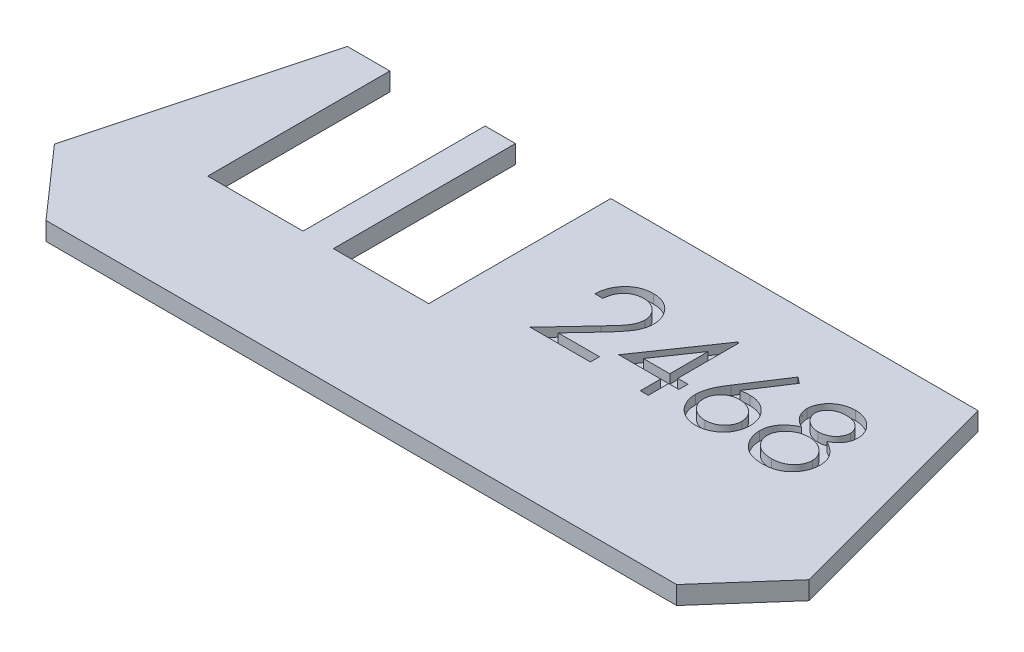
from build123d import *

# Parameters (mm, degrees)
BOSS_EXTRUDE1_DEPTH = 1.524
CUT_EXTRUDE1_REACH  = 36.032
SKETCH3_W           = 7.9756
SKETCH3_H           = 15.24
CUT_EXTRUDE2_DEPTH  = 0.762


with BuildPart() as part:
    # Sketch1 → Boss-Extrude1 (new body)
    with BuildSketch(Plane(origin=(0, 0, 0), x_dir=(1, 0, 0), z_dir=(0, 1, 0))):
        Polygon((-26.3906, 12.6111), (-31.5722, -6.726894464), (-26.3906, -12.6111), (26.3906, -12.6111), (31.5722, -6.726894464), (26.3906, 12.6111), align=None)
    extrude(amount=BOSS_EXTRUDE1_DEPTH)

    # Sketch3 → Cut-Extrude1 (cut, up to next)
    with BuildSketch(Plane(origin=(0, 1.524, 0), x_dir=(1, 0, 0), z_dir=(0, 1, 0)), mode=Mode.PRIVATE) as cut_extrude1_sk1:
        with Locations((-18.8468, 4.9911)):
            Rectangle(SKETCH3_W, SKETCH3_H)
    cut_extrude1_tool1 = extrude(cut_extrude1_sk1.sketch, amount=-CUT_EXTRUDE1_REACH, mode=Mode.PRIVATE) & part.part
    # Sketch3 → Cut-Extrude1 (cut, up to next)
    with BuildSketch(Plane(origin=(0, 1.524, 0), x_dir=(1, 0, 0), z_dir=(0, 1, 0)), mode=Mode.PRIVATE) as cut_extrude1_sk2:
        with Locations((-8.3312, 4.9911)):
            Rectangle(SKETCH3_W, SKETCH3_H)
    cut_extrude1_tool2 = extrude(cut_extrude1_sk2.sketch, amount=-CUT_EXTRUDE1_REACH, mode=Mode.PRIVATE) & part.part
    add(cut_extrude1_tool1.solids().sort_by_distance((-18.8468, 1.524, -4.9911))[0], mode=Mode.SUBTRACT)
    add(cut_extrude1_tool2.solids().sort_by_distance((-8.3312, 1.524, -4.9911))[0], mode=Mode.SUBTRACT)

    # Sketch2 → Cut-Extrude2 (cut)
    # profile 1 of 4: a face of its own
    with BuildSketch(Plane(origin=(0, 1.524, 0), x_dir=(1, 0, 0), z_dir=(0, 1, 0))):
        with BuildLine():
            Line((2.562363697, 5.039946154), (1.897513269, 5.039946154))
            add(Edge.make_bspline(
                [(1.897513269, 5.039946154), (1.90184641, 5.128149533), (1.910356583, 5.301378622), (1.950209795, 5.553947557), (2.007234652, 5.795363548), (2.087861563, 6.023688199), (2.187993184, 6.240940341), (2.308071742, 6.446257041), (2.450298725, 6.638855057), (2.611602979, 6.816948942), (2.786796598, 6.9803293), (2.975827504, 7.121416231), (3.174466145, 7.240621969), (3.382109873, 7.340277264), (3.601101399, 7.415079938), (3.829453448, 7.470582408), (4.068169287, 7.503975673), (4.230814, 7.507565086), (4.313532233, 7.509390598)],
                knots=[0, 0, 0, 0, 1.10065271, 2.161652631, 3.183658789, 4.190468796, 5.17591951, 6.163126047, 7.15150782, 8.156236427, 9.156009102, 10.134482811, 11.092018607, 12.041330605, 13.001268258, 13.972401359, 14.968799086, 16, 16, 16, 16], degree=3))
            add(Edge.make_bspline(
                [(4.313532233, 7.509390598), (4.394765823, 7.507488865), (4.554386926, 7.503752028), (4.787351523, 7.471661183), (5.00913013, 7.421399681), (5.219289236, 7.35088205), (5.416152072, 7.256088345), (5.601197517, 7.142216888), (5.776628566, 7.010518245), (5.934546258, 6.85546434), (6.079555026, 6.68993596), (6.204654799, 6.513219897), (6.311785995, 6.330701242), (6.401083251, 6.140988215), (6.466818745, 5.942294539), (6.516725952, 5.737512959), (6.544935644, 5.524523776), (6.549265124, 5.3803649), (6.551466261, 5.307073558)],
                knots=[0, 0, 0, 0, 1.111607364, 2.184268762, 3.212621178, 4.221274766, 5.211760367, 6.196651075, 7.1921475, 8.207485113, 9.220403448, 10.201281604, 11.166441695, 12.114753415, 13.065576456, 14.026450734, 14.996634279, 16, 16, 16, 16], degree=3))
            add(Edge.make_bspline(
                [(6.551466261, 5.307073558), (6.547882188, 5.203890641), (6.540776937, 4.999335522), (6.479998173, 4.698737396), (6.385073058, 4.407497992), (6.270778653, 4.173104036), (6.155478646, 3.984226474), (6.051576755, 3.828717716), (5.929942905, 3.661277808), (5.788806751, 3.482467444), (5.631087838, 3.290886028), (5.455357593, 3.086649294), (5.260362889, 2.871867381), (5.123502396, 2.725170525), (5.052584717, 2.649155889)],
                knots=[0, 0, 0, 0, 1.184426356, 2.348067706, 3.509069118, 4.696110526, 5.333549288, 6.050745305, 6.844228056, 7.710549037, 8.667450064, 9.695053472, 10.805634456, 12, 12, 12, 12], degree=3))
            Line((5.052584717, 2.649155889), (3.199017343, 0.67092906))
            Line((3.199017343, 0.67092906), (6.646444893, 0.67092906))
            Line((6.646444893, 0.67092906), (6.646444893, -0.0889))
            Line((6.646444893, -0.0889), (1.612577372, -0.0889))
            Line((1.612577372, -0.0889), (4.485681004, 2.97712898))
            add(Edge.make_bspline(
                [(4.485681004, 2.97712898), (4.555632365, 3.050150395), (4.689994612, 3.19040959), (4.8800344, 3.395182189), (5.050720258, 3.58515205), (5.203157073, 3.759960245), (5.334037993, 3.92216373), (5.450184217, 4.066509186), (5.543244718, 4.199339439), (5.644242306, 4.353307072), (5.742061899, 4.541293143), (5.82611972, 4.771022785), (5.877374482, 5.007512137), (5.883523051, 5.167324782), (5.886615833, 5.247711912)],
                knots=[0, 0, 0, 0, 1.329631726, 2.553950428, 3.673215718, 4.687767853, 5.603093632, 6.413772471, 7.123043292, 7.734684054, 8.834405432, 9.900288307, 10.943827018, 12, 12, 12, 12], degree=3))
            add(Edge.make_bspline(
                [(5.886615833, 5.247711912), (5.885270179, 5.298260872), (5.882618152, 5.397883166), (5.859212693, 5.543945356), (5.823842121, 5.684840878), (5.773157992, 5.821003122), (5.706257059, 5.951063085), (5.624821738, 6.075179085), (5.53086277, 6.195170728), (5.42216925, 6.307678542), (5.302764867, 6.410720427), (5.176623705, 6.501999742), (5.043167651, 6.578282526), (4.902959392, 6.640816262), (4.756389815, 6.689870819), (4.603175438, 6.723861478), (4.443739604, 6.745202736), (4.334872038, 6.748090233), (4.279399287, 6.749561538)],
                knots=[0, 0, 0, 0, 0.991446411, 1.95395049, 2.89581595, 3.838931463, 4.798493298, 5.75982156, 6.748411868, 7.785213223, 8.824556874, 9.840280684, 10.836137867, 11.835679398, 12.848801643, 13.863922112, 14.911575587, 16, 16, 16, 16], degree=3))
            add(Edge.make_bspline(
                [(4.279399287, 6.749561538), (4.221464358, 6.748048054), (4.107689722, 6.745075819), (3.940644436, 6.724284513), (3.78128954, 6.688415818), (3.629224179, 6.639358524), (3.484191056, 6.577004596), (3.346895496, 6.499340403), (3.217645713, 6.406665342), (3.096198739, 6.301592831), (2.984303317, 6.184609742), (2.885990763, 6.054201987), (2.800087933, 5.912750624), (2.725138389, 5.760637326), (2.664272178, 5.596481825), (2.617762343, 5.420866849), (2.580960184, 5.234554925), (2.568665482, 5.105893162), (2.562363697, 5.039946154)],
                knots=[0, 0, 0, 0, 1.031018746, 2.02475058, 2.990194455, 3.934040569, 4.864654155, 5.795059489, 6.735614925, 7.690564532, 8.649604399, 9.611025574, 10.590972636, 11.591080095, 12.624614302, 13.701020113, 14.821632451, 16, 16, 16, 16], degree=3))
        make_face()
    # profile 2 of 4: a face of its own
    with BuildSketch(Plane(origin=(0, 1.524, 0), x_dir=(1, 0, 0), z_dir=(0, 1, 0))):
        Polygon((11.355307407, 7.509390598), (11.49035515, 7.509390598), (11.49035515, 2.380544444), (12.345162842, 2.380544444), (12.345162842, 1.620715385), (11.49035515, 1.620715385), (11.49035515, -0.0889), (10.825504722, -0.0889), (10.825504722, 1.620715385), (7.311295321, 1.620715385), align=None)
        Polygon((10.825504722, 2.380544444), (10.825504722, 5.59794562), (8.617251517, 2.380544444), align=None, mode=Mode.SUBTRACT)
    # profile 3 of 4: a face of its own
    with BuildSketch(Plane(origin=(0, 1.524, 0), x_dir=(1, 0, 0), z_dir=(0, 1, 0))):
        with BuildLine():
            Line((16.429244039, 7.509390598), (16.941238229, 7.107215451))
            Line((16.941238229, 7.107215451), (14.983787976, 4.113904487))
            add(Edge.make_bspline(
                [(14.983787976, 4.113904487), (15.114111729, 4.134677159), (15.368322944, 4.175196604), (15.625637429, 4.181880922), (15.751037241, 4.185138462)],
                knots=[0, 0, 0, 0, 1.025318673, 2, 2, 2, 2], degree=3))
            add(Edge.make_bspline(
                [(15.751037241, 4.185138462), (15.826332358, 4.183114692), (15.974548556, 4.179130961), (16.192156287, 4.148473477), (16.401259535, 4.100160324), (16.600991614, 4.029734049), (16.792069426, 3.939770732), (16.975589498, 3.831950123), (17.148102086, 3.700704766), (17.311828748, 3.554093943), (17.460476105, 3.391709659), (17.592082089, 3.219410163), (17.702628798, 3.037374965), (17.792320265, 2.845696266), (17.861968925, 2.644669533), (17.912742774, 2.434551971), (17.942756245, 2.21519869), (17.946831867, 2.066019886), (17.948902158, 1.990241627)],
                knots=[0, 0, 0, 0, 1.04369286, 2.054478336, 3.041073146, 4.015093852, 4.984733326, 5.965804835, 6.960378782, 7.985147595, 9.009457201, 10.008161701, 10.986880575, 11.956520048, 12.937015923, 13.931873656, 14.949455224, 16, 16, 16, 16], degree=3))
            add(Edge.make_bspline(
                [(17.948902158, 1.990241627), (17.94588992, 1.88656792), (17.939962547, 1.6825626), (17.880899512, 1.385431905), (17.789121597, 1.102364747), (17.657935829, 0.837880534), (17.494989785, 0.592341762), (17.296282214, 0.374779194), (17.068860163, 0.180744281), (16.811713107, 0.018487771), (16.534973833, -0.114022021), (16.244245439, -0.20919845), (15.942351312, -0.267795127), (15.737448225, -0.275141235), (15.633797992, -0.278857265)],
                knots=[0, 0, 0, 0, 1.031375318, 2.029502543, 3.004789286, 3.987476834, 4.960371455, 5.9300674, 6.912260825, 7.929083631, 8.949397511, 9.960523116, 10.96833055, 12, 12, 12, 12], degree=3))
            add(Edge.make_bspline(
                [(15.633797992, -0.278857265), (15.534109975, -0.275622563), (15.336645469, -0.269215184), (15.046169388, -0.212137282), (14.767059334, -0.119623915), (14.501270811, 0.007829641), (14.255058847, 0.168818827), (14.034786584, 0.362625651), (13.841552327, 0.585107352), (13.68073938, 0.836229421), (13.55319173, 1.106083164), (13.457539722, 1.387466812), (13.401667674, 1.679355106), (13.393860229, 1.877223518), (13.389927799, 1.976885256)],
                knots=[0, 0, 0, 0, 1.012016664, 2.004627821, 2.994792927, 3.992885782, 4.990978636, 5.973936114, 6.964471063, 7.975201453, 8.993600317, 9.990122807, 10.98767138, 12, 12, 12, 12], degree=3))
            add(Edge.make_bspline(
                [(13.389927799, 1.976885256), (13.392428525, 2.053179624), (13.397534528, 2.208958146), (13.433186371, 2.444890338), (13.49047352, 2.686298461), (13.554630208, 2.891094838), (13.622417749, 3.058865059), (13.678832291, 3.194127448), (13.749050583, 3.333321719), (13.82392424, 3.481220916), (13.910192945, 3.634013415), (14.003994403, 3.794252849), (14.107921998, 3.959390795), (14.180778009, 4.071456009), (14.218022751, 4.128744899)],
                knots=[0, 0, 0, 0, 1.173818275, 2.396712641, 3.66331629, 4.989737886, 5.693666774, 6.447286557, 7.243889047, 8.091586357, 8.998013824, 9.943181721, 10.948533338, 12, 12, 12, 12], degree=3))
            Line((14.218022751, 4.128744899), (16.429244039, 7.509390598))
        make_face()
        with BuildLine():
            add(Edge.make_bspline(
                [(15.611537375, 3.425309402), (15.55510229, 3.423662543), (15.444868175, 3.420445748), (15.283139147, 3.401765632), (15.130076098, 3.36658861), (14.983651165, 3.32178654), (14.846601861, 3.260185064), (14.71793215, 3.185357089), (14.597144457, 3.097258929), (14.485503939, 2.997138667), (14.384285651, 2.887520664), (14.297118924, 2.770110175), (14.221929844, 2.647736779), (14.160796661, 2.519378001), (14.113192667, 2.38508291), (14.078758203, 2.245469166), (14.05959443, 2.099600551), (14.05640624, 2.00068342), (14.054778227, 1.950172516)],
                knots=[0, 0, 0, 0, 1.129588631, 2.206414736, 3.251139165, 4.268635594, 5.265702196, 6.250456724, 7.242448911, 8.251968645, 9.246821453, 10.222880186, 11.173611482, 12.116736599, 13.062300278, 14.020270554, 14.989073742, 16, 16, 16, 16], degree=3))
            add(Edge.make_bspline(
                [(14.054778227, 1.950172516), (14.056104025, 1.900113392), (14.058703719, 1.801954902), (14.082309462, 1.657303639), (14.118367053, 1.518101249), (14.172004224, 1.385065365), (14.235984471, 1.256168159), (14.320450741, 1.136078471), (14.414042937, 1.017502656), (14.525917096, 0.909549541), (14.645981548, 0.809099687), (14.774254093, 0.721299817), (14.907942675, 0.646187417), (15.048852185, 0.587320593), (15.194983431, 0.539009186), (15.347553937, 0.505012388), (15.506669815, 0.485791942), (15.614454584, 0.482599599), (15.669414979, 0.480971795)],
                knots=[0, 0, 0, 0, 0.989467248, 1.94019797, 2.891935182, 3.827694429, 4.772920941, 5.730924762, 6.725747692, 7.756678648, 8.79901574, 9.819492441, 10.826891316, 11.826466727, 12.835195252, 13.867842842, 14.912794438, 16, 16, 16, 16], degree=3))
            add(Edge.make_bspline(
                [(15.669414979, 0.480971795), (15.724375284, 0.482599726), (15.832159876, 0.48579232), (15.991277034, 0.505010952), (16.143842808, 0.539014457), (16.289991251, 0.587301487), (16.43083728, 0.646258294), (16.564408941, 0.720832524), (16.691468406, 0.80963964), (16.811611675, 0.90937788), (16.923020177, 1.018117083), (17.018857084, 1.135019996), (17.100736595, 1.257138741), (17.167272291, 1.384557608), (17.220318691, 1.51818169), (17.25655913, 1.657282089), (17.280116124, 1.801960544), (17.282722516, 1.900115297), (17.284051731, 1.950172516)],
                knots=[0, 0, 0, 0, 1.087397944, 2.132534446, 3.165364764, 4.174271784, 5.174024072, 6.181601208, 7.194203697, 8.236725232, 9.267838612, 10.269026844, 11.221737037, 12.171628256, 13.107553087, 14.05945871, 15.010357665, 16, 16, 16, 16], degree=3))
            add(Edge.make_bspline(
                [(17.284051731, 1.950172516), (17.282886944, 2.000749315), (17.280600846, 2.100015124), (17.254743755, 2.245403916), (17.218882397, 2.385792269), (17.164731649, 2.520297862), (17.094380962, 2.648389908), (17.008691084, 2.770715463), (16.909562144, 2.888212365), (16.795055685, 2.997353642), (16.67040469, 3.097148291), (16.537868367, 3.185243018), (16.399209823, 3.259590886), (16.254569645, 3.321624252), (16.102290543, 3.366390639), (15.944830992, 3.401640003), (15.780177095, 3.420397941), (15.668466607, 3.423651396), (15.611537375, 3.425309402)],
                knots=[0, 0, 0, 0, 0.978206639, 1.919901502, 2.851605144, 3.780102724, 4.718870031, 5.675451981, 6.667674623, 7.690630536, 8.733308323, 9.756129687, 10.767539656, 11.776269907, 12.797430371, 13.836405707, 14.897401972, 16, 16, 16, 16], degree=3))
        make_face(mode=Mode.SUBTRACT)
    # profile 4 of 4: a face of its own
    with BuildSketch(Plane(origin=(0, 1.524, 0), x_dir=(1, 0, 0), z_dir=(0, 1, 0))):
        with BuildLine():
            add(Edge.make_bspline(
                [(22.310499047, 4.038218389), (22.371138471, 4.006599716), (22.489405601, 3.944932743), (22.657844025, 3.845638158), (22.811778611, 3.740988116), (22.9554803, 3.635925547), (23.086424393, 3.526426884), (23.203146734, 3.412056704), (23.308530529, 3.295669786), (23.400450555, 3.175295291), (23.481300526, 3.051253017), (23.551176212, 2.923217389), (23.610902625, 2.791469), (23.658237512, 2.654569709), (23.697230304, 2.514530489), (23.724060335, 2.369543094), (23.738489478, 2.220562906), (23.741217466, 2.119876667), (23.742598739, 2.068895807)],
                knots=[0, 0, 0, 0, 1.272397273, 2.481599622, 3.635517121, 4.734568067, 5.792894095, 6.808321871, 7.773003508, 8.711915296, 9.623354172, 10.525449501, 11.423591555, 12.311487226, 13.218079475, 14.126165749, 15.051214107, 16, 16, 16, 16], degree=3))
            add(Edge.make_bspline(
                [(23.742598739, 2.068895807), (23.740965899, 1.997568939), (23.737733896, 1.856386306), (23.709582263, 1.648008703), (23.667433125, 1.445630431), (23.605881491, 1.249295859), (23.526054814, 1.060088352), (23.427678844, 0.877845948), (23.31631846, 0.699581744), (23.226884554, 0.589897344), (23.181631191, 0.534397276)],
                knots=[0, 0, 0, 0, 1.025265484, 2.029385089, 3.018602448, 3.995076438, 4.983346944, 5.966715145, 6.97116228, 8, 8, 8, 8], degree=3))
            add(Edge.make_bspline(
                [(23.181631191, 0.534397276), (23.122710654, 0.469640454), (23.005597677, 0.340927028), (22.804973814, 0.17381448), (22.584794159, 0.033374929), (22.345910689, -0.081077248), (22.088961957, -0.170158983), (21.814002714, -0.234172312), (21.520496924, -0.270838121), (21.31876701, -0.276138232), (21.215276691, -0.278857265)],
                knots=[0, 0, 0, 0, 0.954267603, 1.896743057, 2.838368354, 3.796610408, 4.779680527, 5.799409237, 6.871065594, 8, 8, 8, 8], degree=3))
            add(Edge.make_bspline(
                [(21.215276691, -0.278857265), (21.115765018, -0.276417853), (20.922125411, -0.271671006), (20.64027457, -0.239509459), (20.377547406, -0.183147141), (20.132416306, -0.106006052), (19.906359072, -0.005654402), (19.700019841, 0.11924673), (19.5104216, 0.263669949), (19.343318231, 0.431763082), (19.194964358, 0.611802245), (19.064645312, 0.797543152), (18.956326846, 0.989002759), (18.864617828, 1.183326236), (18.79441218, 1.383237262), (18.745787668, 1.58770729), (18.714906953, 1.796379176), (18.710798218, 1.937204509), (18.708731218, 2.00805012)],
                knots=[0, 0, 0, 0, 1.256902934, 2.445805442, 3.576955095, 4.645999104, 5.686449165, 6.692658513, 7.68621702, 8.689161843, 9.678783111, 10.630372946, 11.551080876, 12.453998257, 13.34127905, 14.221779781, 15.105423033, 16, 16, 16, 16], degree=3))
            add(Edge.make_bspline(
                [(18.708731218, 2.00805012), (18.7099544, 2.060033743), (18.712371838, 2.162771731), (18.729103767, 2.314556476), (18.756003343, 2.462291628), (18.79253586, 2.606522868), (18.842046866, 2.746200162), (18.901826048, 2.881985331), (18.971532014, 3.014031674), (19.052137147, 3.143061306), (19.145909764, 3.267266273), (19.25208949, 3.388754462), (19.372798478, 3.505640747), (19.506693856, 3.619353213), (19.652245465, 3.731909024), (19.813233904, 3.837225317), (19.985391438, 3.942758009), (20.107746213, 4.005852298), (20.170511734, 4.038218389)],
                knots=[0, 0, 0, 0, 0.941657376, 1.861047343, 2.762797495, 3.66048619, 4.553285746, 5.444104102, 6.34607688, 7.256116206, 8.197091036, 9.162375105, 10.176350973, 11.237807142, 12.343728897, 13.50695164, 14.721116704, 16, 16, 16, 16], degree=3))
            add(Edge.make_bspline(
                [(20.170511734, 4.038218389), (20.084593324, 4.085070316), (19.918231234, 4.175788761), (19.697950917, 4.3424695), (19.508740764, 4.522995375), (19.355801612, 4.721178441), (19.235422062, 4.930827658), (19.152832683, 5.150631325), (19.096960125, 5.376513766), (19.091425407, 5.530831882), (19.088645748, 5.608333908)],
                knots=[0, 0, 0, 0, 1.166880483, 2.259407225, 3.286803203, 4.280235371, 5.237608625, 6.161067461, 7.076446754, 8, 8, 8, 8], degree=3))
            add(Edge.make_bspline(
                [(19.088645748, 5.608333908), (19.092107396, 5.687280406), (19.099065911, 5.845976636), (19.15533394, 6.082209597), (19.247028081, 6.314231327), (19.371744191, 6.540917252), (19.527080465, 6.754595206), (19.713445654, 6.946240209), (19.926389299, 7.114116181), (20.164848451, 7.255035746), (20.421465149, 7.369724491), (20.692220098, 7.448842152), (20.972395842, 7.500565266), (21.163102682, 7.506421352), (21.259797925, 7.509390598)],
                knots=[0, 0, 0, 0, 0.888701115, 1.786444228, 2.72001202, 3.692817113, 4.693886446, 5.687152267, 6.695133018, 7.739871481, 8.800368666, 9.853104506, 10.91144658, 12, 12, 12, 12], degree=3))
            add(Edge.make_bspline(
                [(21.259797925, 7.509390598), (21.353997667, 7.506329172), (21.539748826, 7.500292388), (21.812787454, 7.449943496), (22.074036778, 7.365849346), (22.322595884, 7.25176689), (22.554015004, 7.111247865), (22.758489891, 6.941066015), (22.939110523, 6.7502664), (23.088514158, 6.536653239), (23.211625607, 6.310838363), (23.297352514, 6.074570694), (23.352284193, 5.832955186), (23.359212814, 5.669468077), (23.36268421, 5.587557332)],
                knots=[0, 0, 0, 0, 1.072916533, 2.115669174, 3.151510826, 4.193348718, 5.225979165, 6.227137561, 7.216255879, 8.211077061, 9.189680878, 10.138522389, 11.067357538, 12, 12, 12, 12], degree=3))
            add(Edge.make_bspline(
                [(23.36268421, 5.587557332), (23.359647723, 5.507173393), (23.353684236, 5.349303907), (23.303519364, 5.119166105), (23.219036183, 4.903642789), (23.103690205, 4.700288374), (22.953352923, 4.512790871), (22.770031105, 4.338766009), (22.555186309, 4.176784223), (22.393767433, 4.085373085), (22.310499047, 4.038218389)],
                knots=[0, 0, 0, 0, 0.975232327, 1.915300861, 2.843280834, 3.77672583, 4.742871857, 5.749627742, 6.839139064, 8, 8, 8, 8], degree=3))
        make_face()
        with BuildLine():
            add(Edge.make_bspline(
                [(21.222696897, 6.749561538), (21.170731024, 6.748182656), (21.069063055, 6.745484959), (20.919989035, 6.731390844), (20.778230857, 6.703973202), (20.642307413, 6.667484596), (20.51408226, 6.618191687), (20.391813953, 6.560205584), (20.277583401, 6.489707746), (20.170011643, 6.410626544), (20.073172504, 6.323646559), (19.987226203, 6.233024188), (19.915835028, 6.136979608), (19.855211346, 6.037901913), (19.811223801, 5.932850527), (19.778279358, 5.825046203), (19.756009079, 5.71312664), (19.75434032, 5.636637693), (19.753496175, 5.59794562)],
                knots=[0, 0, 0, 0, 1.203892937, 2.355340988, 3.463153438, 4.544400666, 5.610487187, 6.640501085, 7.674077295, 8.714426146, 9.728707835, 10.68524104, 11.601827946, 12.495867327, 13.368432065, 14.231010473, 15.105153427, 16, 16, 16, 16], degree=3))
            add(Edge.make_bspline(
                [(19.753496175, 5.59794562), (19.754951102, 5.559251874), (19.757826246, 5.482787475), (19.7800621, 5.369872059), (19.813202443, 5.258912928), (19.865379676, 5.1525485), (19.927961801, 5.047089056), (20.005202092, 4.945170316), (20.097253868, 4.846437584), (20.201028617, 4.751730634), (20.314083039, 4.663044918), (20.433852597, 4.586055018), (20.558834125, 4.52163615), (20.687743505, 4.468022244), (20.821894552, 4.42634521), (20.960465254, 4.396778241), (21.103478901, 4.378401348), (21.20038113, 4.37620632), (21.249409637, 4.375095726)],
                knots=[0, 0, 0, 0, 0.873023192, 1.725219244, 2.590779336, 3.480155217, 4.391973325, 5.357036234, 6.360879153, 7.436073238, 8.526419356, 9.601555421, 10.645666583, 11.697338044, 12.750135903, 13.812665442, 14.89329948, 16, 16, 16, 16], degree=3))
            add(Edge.make_bspline(
                [(21.249409637, 4.375095726), (21.31238069, 4.376943295), (21.437700835, 4.380620185), (21.622442087, 4.414806836), (21.802068017, 4.468582695), (21.974658698, 4.542157957), (22.135746737, 4.634503593), (22.279341548, 4.745063482), (22.404218305, 4.871284754), (22.509079263, 5.011202423), (22.590380105, 5.160113285), (22.653672264, 5.309550571), (22.690631837, 5.461108627), (22.695452687, 5.5626387), (22.697833782, 5.612786031)],
                knots=[0, 0, 0, 0, 1.076279235, 2.141928126, 3.20205304, 4.278698113, 5.344010996, 6.36967002, 7.368914609, 8.37248503, 9.349703398, 10.264243087, 11.142681841, 12, 12, 12, 12], degree=3))
            add(Edge.make_bspline(
                [(22.697833782, 5.612786031), (22.696707932, 5.64798204), (22.694473282, 5.717841074), (22.676058163, 5.821003947), (22.645629317, 5.921819899), (22.604432464, 6.021121772), (22.550225065, 6.117516322), (22.485954201, 6.212518858), (22.407882007, 6.303992225), (22.320259556, 6.394068136), (22.220891775, 6.477430986), (22.10997016, 6.550741123), (21.988063389, 6.612997277), (21.855168578, 6.663561808), (21.711775155, 6.701539782), (21.558543571, 6.729980051), (21.394196158, 6.746009804), (21.281103185, 6.748351949), (21.222696897, 6.749561538)],
                knots=[0, 0, 0, 0, 0.814439003, 1.616544685, 2.417341072, 3.248991801, 4.09997495, 4.973547432, 5.9003056, 6.880240646, 7.880314356, 8.896779544, 9.951930927, 11.043077905, 12.18215768, 13.381699519, 14.647792085, 16, 16, 16, 16], degree=3))
        make_face(mode=Mode.SUBTRACT)
        with BuildLine():
            add(Edge.make_bspline(
                [(21.265734089, 3.615266667), (21.199851177, 3.614094792), (21.070604977, 3.611795861), (20.88125448, 3.586206419), (20.699531946, 3.550584203), (20.52605008, 3.496543928), (20.360882142, 3.426278024), (20.203133997, 3.341749915), (20.05401244, 3.241831726), (19.915576669, 3.12779289), (19.789162288, 3.004900379), (19.678252553, 2.874805527), (19.584066135, 2.739926166), (19.508219087, 2.59854928), (19.445964254, 2.453668504), (19.405083214, 2.301675761), (19.378875258, 2.145493038), (19.375356021, 2.039320829), (19.373581645, 1.985789503)],
                knots=[0, 0, 0, 0, 1.140299081, 2.23698856, 3.303958914, 4.344563908, 5.37730929, 6.408454204, 7.439741482, 8.480804886, 9.510774543, 10.48932336, 11.43758569, 12.353841022, 13.263987381, 14.161954604, 15.073269652, 16, 16, 16, 16], degree=3))
            add(Edge.make_bspline(
                [(19.373581645, 1.985789503), (19.37646721, 1.919260752), (19.382192102, 1.787269264), (19.427608654, 1.592190763), (19.500497205, 1.40333953), (19.602150578, 1.222254564), (19.728023607, 1.053026839), (19.882807964, 0.90551893), (20.056884404, 0.774451801), (20.256142862, 0.668448005), (20.473796448, 0.583792228), (20.709787274, 0.525465441), (20.960728519, 0.486854372), (21.133997989, 0.482963555), (21.222696897, 0.480971795)],
                knots=[0, 0, 0, 0, 0.898778495, 1.783155532, 2.693654817, 3.627872908, 4.583023416, 5.533784346, 6.509005473, 7.520592997, 8.575161974, 9.658835044, 10.801527049, 12, 12, 12, 12], degree=3))
            add(Edge.make_bspline(
                [(21.222696897, 0.480971795), (21.292018509, 0.482302773), (21.427079239, 0.484895944), (21.624111164, 0.507786201), (21.810048792, 0.544086239), (21.984531548, 0.596883411), (22.149512676, 0.661335862), (22.302194942, 0.744250101), (22.446506158, 0.838552518), (22.575335218, 0.950435616), (22.692668843, 1.06998388), (22.794974312, 1.196539471), (22.883784462, 1.326662893), (22.953488318, 1.463294752), (23.009212222, 1.603813721), (23.049267079, 1.749515554), (23.073981735, 1.90084713), (23.076481298, 2.003503497), (23.077748312, 2.055539436)],
                knots=[0, 0, 0, 0, 1.224942928, 2.386581632, 3.501229538, 4.569074225, 5.605009692, 6.626002462, 7.634866581, 8.645888296, 9.63523824, 10.59253846, 11.518950513, 12.414518923, 13.29783783, 14.186679152, 15.080837789, 16, 16, 16, 16], degree=3))
            add(Edge.make_bspline(
                [(23.077748312, 2.055539436), (23.075830933, 2.106079807), (23.072050195, 2.20573659), (23.048054199, 2.353409072), (23.005898925, 2.496078362), (22.948055935, 2.635460874), (22.871049564, 2.768732453), (22.780361256, 2.899365016), (22.670942038, 3.023732824), (22.547302043, 3.142801877), (22.412557243, 3.252901853), (22.269328453, 3.350299081), (22.118718175, 3.432324394), (21.961045112, 3.499034309), (21.796659369, 3.55150112), (21.625681854, 3.58815331), (21.447912388, 3.611224136), (21.327146244, 3.613903933), (21.265734089, 3.615266667)],
                knots=[0, 0, 0, 0, 0.917430815, 1.809013306, 2.70690318, 3.612392954, 4.541220862, 5.495268465, 6.494511384, 7.542276156, 8.608045339, 9.649016899, 10.681629292, 11.715607085, 12.752076957, 13.808767841, 14.885711793, 16, 16, 16, 16], degree=3))
        make_face(mode=Mode.SUBTRACT)
    extrude(amount=-CUT_EXTRUDE2_DEPTH, mode=Mode.SUBTRACT)


solid = part.part
